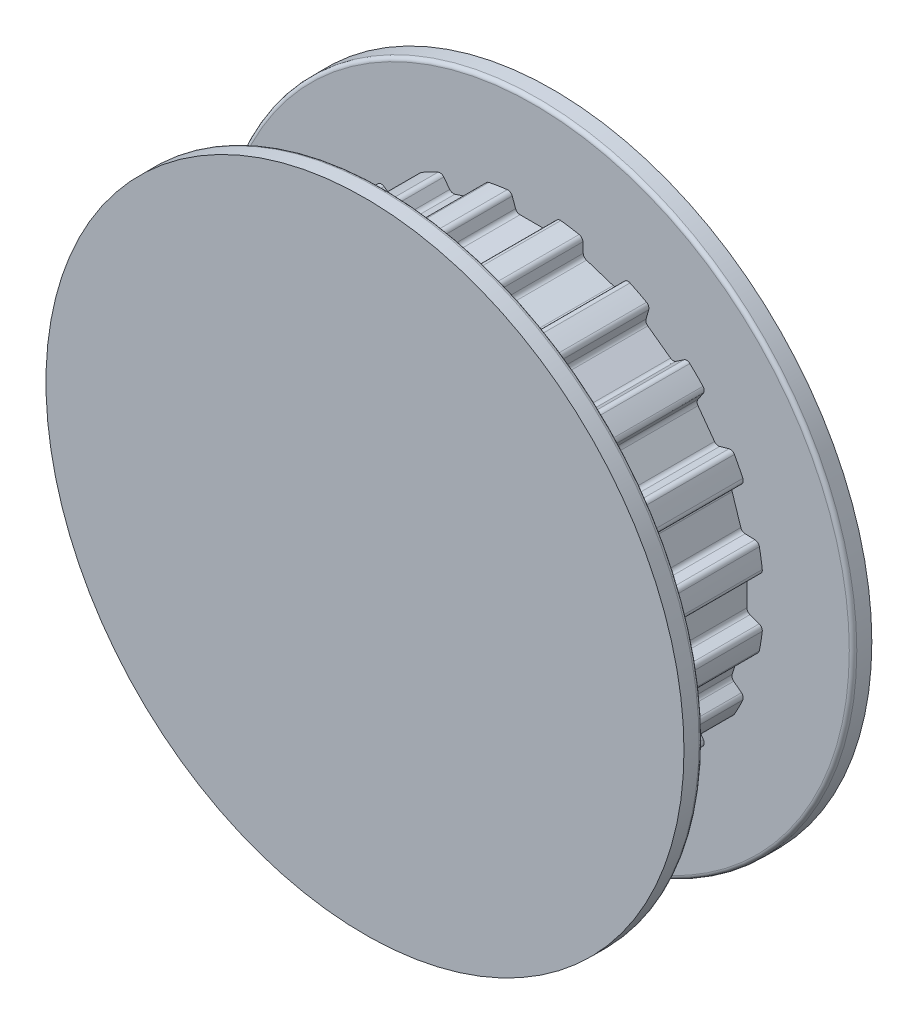
from build123d import *

# Parameters (mm, degrees)
TOOTH_EXTRUDE_START    = -2.032
TOOTH_EXTRUDE_DEPTH    = 4.064
TOOTH_PATTERN_20_COUNT = 20


with BuildPart() as part:
    # GearBelt-BaseSketch → 0.080in Pitch 'MXL', 0.125in Belt Width, 12,9361mm P.D. (revolve)
    with BuildSketch(Plane(origin=(0, 0, 0), x_dir=(0, 0, -1), z_dir=(1, 0, 0)), mode=Mode.PRIVATE) as f_0_080in_pitch_mxl_0_125in_belt_width_sk:
        with BuildLine():
            Line((-2.54, 0), (2.54, 0))
            Line((2.54, 0), (2.54, 8.627057076))
            Line((2.54, 8.627057076), (2.133599999, 8.627057076))
            ThreePointArc((2.133599999, 8.627057076), (2.061757951, 8.597299125), (2.032, 8.525457077))
            Line((2.032, 8.525457077), (2.032, 6.214056887))
            Line((2.032, 6.214056887), (-2.032, 6.214056887))
            Line((-2.032, 6.214056887), (-2.032, 8.525457077))
            ThreePointArc((-2.032, 8.525457077), (-2.061757951, 8.597299125), (-2.133599999, 8.627057076))
            Line((-2.133599999, 8.627057076), (-2.54, 8.627057076))
            Line((-2.54, 8.627057076), (-2.54, 0))
        make_face()
    revolve(f_0_080in_pitch_mxl_0_125in_belt_width_sk.sketch.rotate(Axis((0, 0, 3.048), (0, 0, -1)), 90), axis=Axis((0, 0, 3.048), (0, 0, -1)))

    # Tooth-Sketch → Tooth-Extrude (cut)
    with BuildSketch(Plane.XY.offset(TOOTH_EXTRUDE_START)):
        with BuildLine():
            Line((-0.379703626, 5.756856897), (0.379703626, 5.756856897))
            ThreePointArc((0.379703626, 5.756856897), (0.452547836, 5.779824588), (0.499044593, 5.840420341))
            Line((0.499044593, 5.840420341), (0.589547328, 6.089074564))
            ThreePointArc((0.589547328, 6.089074564), (0.642236151, 6.153742087), (0.7236785, 6.171773848))
            Line((0.7236785, 6.171773848), (0.7236785, 8.711773848))
            Line((0.7236785, 8.711773848), (-0.7236785, 8.711773848))
            Line((-0.7236785, 8.711773848), (-0.7236785, 6.171773848))
            ThreePointArc((-0.7236785, 6.171773848), (-0.642236151, 6.153742087), (-0.589547328, 6.089074564))
            Line((-0.589547328, 6.089074564), (-0.499044593, 5.840420341))
            ThreePointArc((-0.499044593, 5.840420341), (-0.452547836, 5.779824588), (-0.379703626, 5.756856897))
        make_face()
    tooth_extrude = extrude(amount=TOOTH_EXTRUDE_DEPTH, mode=Mode.SUBTRACT)

    # Tooth Pattern, 20: Tooth-Extrude ×20 about axis
    tooth_pattern_20_axis = Axis((0, 0, 0), (0, 0, 1))
    for i in range(1, TOOTH_PATTERN_20_COUNT):
        add(tooth_extrude.rotate(tooth_pattern_20_axis, i * 360 / TOOTH_PATTERN_20_COUNT), mode=Mode.SUBTRACT)


solid = part.part
